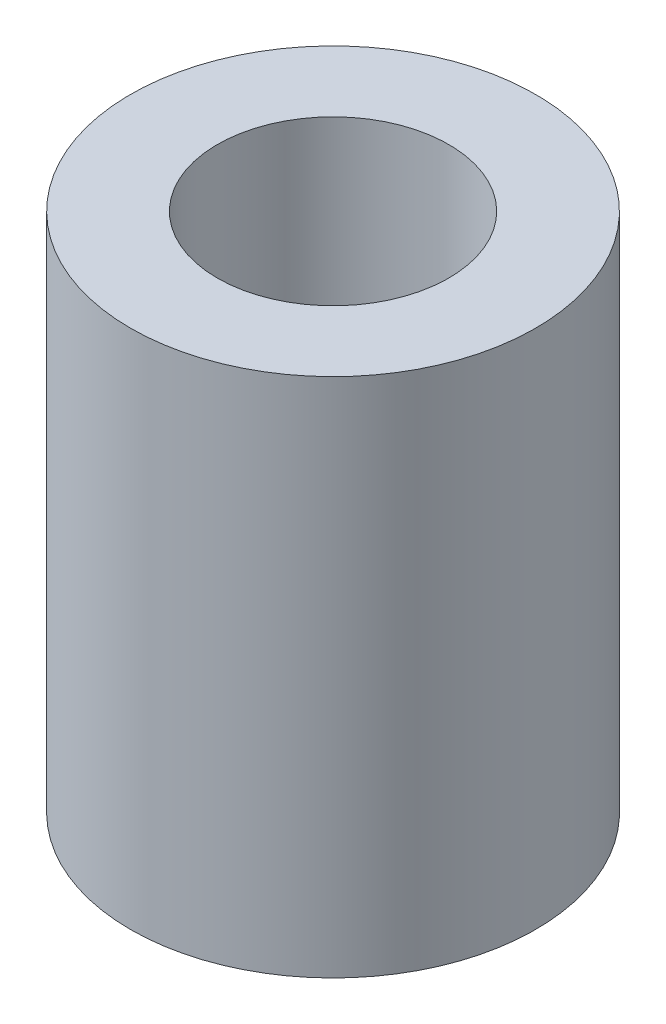
from build123d import *

# Parameters (mm, degrees)
SKETCH1_R           = 3.5
SKETCH1_R_2         = 2
BOSS_EXTRUDE1_DEPTH = 9


with BuildPart() as part:
    # Sketch1 → Boss-Extrude1 (new body)
    with BuildSketch(Plane(origin=(0, 0, 0), x_dir=(1, 0, 0), z_dir=(0, 1, 0))):
        with Locations(Location((0, 0, 0), (0, 0, 270))):
            Circle(SKETCH1_R)
        with Locations(Location((0, 0, 0), (0, 0, 270))):
            Circle(SKETCH1_R_2, mode=Mode.SUBTRACT)
    extrude(amount=BOSS_EXTRUDE1_DEPTH)


solid = part.part
